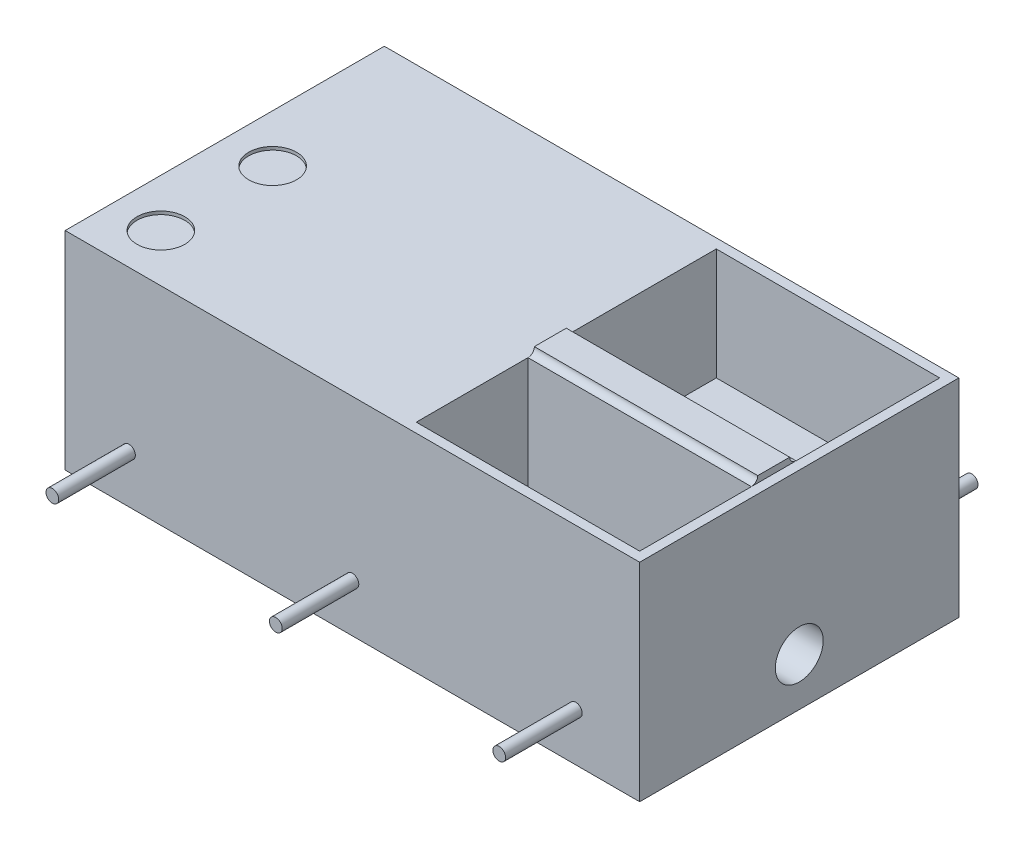
from build123d import *

# Parameters (mm, degrees)
SKIZZE1_W                            = 1800
SKIZZE1_H                            = 1000
AUFSATZ_LINEAR_AUSTRAGEN1_DEPTH      = 650
AUFSATZ_LINEAR_AUSTRAGEN2_DEPTH      = 740
AUFSATZ_LINEAR_AUSTRAGEN2_DEPTH_BACK = 740
SKIZZE2_R                            = 20
SKIZZE3_W                            = 700
SKIZZE3_H                            = 450
SKIZZE3_H_2                          = 350
SCHNITT_LINEAR_AUSTRAGEN1_DEPTH      = 350
SKIZZE4_W                            = 700
SKIZZE4_H                            = 140
AUFSATZ_LINEAR_AUSTRAGEN3_DEPTH      = 20
SKIZZE5_R                            = 20
SCHNITT_LINEAR_AUSTRAGEN2_DEPTH      = 700
SKIZZE6_R                            = 75
SCHNITT_LINEAR_AUSTRAGEN3_DEPTH      = 1800
SKIZZE7_R                            = 75
SCHNITT_LINEAR_AUSTRAGEN4_DEPTH      = 10
SKIZZE8_R                            = 75
SCHNITT_LINEAR_AUSTRAGEN5_DEPTH      = 10


with BuildPart() as part:
    # Skizze1 → Aufsatz-Linear austragen1 (new body)
    with BuildSketch(Plane(origin=(0, 0, 0), x_dir=(1, 0, 0), z_dir=(0, 1, 0))):
        Rectangle(SKIZZE1_W, SKIZZE1_H)
    extrude(amount=-AUFSATZ_LINEAR_AUSTRAGEN1_DEPTH)

    # Skizze2 → Aufsatz-Linear austragen2 (add, two sides: drawn at the far end of the back side and taken through both)
    with BuildSketch(Plane.XY.offset(-AUFSATZ_LINEAR_AUSTRAGEN2_DEPTH_BACK)):
        with Locations((0, -500)):
            Circle(SKIZZE2_R)
        with Locations((-700, -500)):
            Circle(SKIZZE2_R)
        with Locations(Location((700, -500, 0), (0, 0, 180))):
            Circle(SKIZZE2_R)
    extrude(amount=AUFSATZ_LINEAR_AUSTRAGEN2_DEPTH + AUFSATZ_LINEAR_AUSTRAGEN2_DEPTH_BACK)

    # Skizze3 → Schnitt-Linear austragen1 (cut)
    with BuildSketch(Plane(origin=(0, 0, 0), x_dir=(1, 0, 0), z_dir=(0, 1, 0))):
        with Locations((520, 245)):
            Rectangle(SKIZZE3_W, SKIZZE3_H)
        with Locations((520, -295)):
            Rectangle(SKIZZE3_W, SKIZZE3_H_2)
    extrude(amount=-SCHNITT_LINEAR_AUSTRAGEN1_DEPTH, mode=Mode.SUBTRACT)

    # Skizze4 → Aufsatz-Linear austragen3 (add)
    with BuildSketch(Plane(origin=(0, 0, 0), x_dir=(1, 0, 0), z_dir=(0, 1, 0))):
        with Locations((520, -50)):
            Rectangle(SKIZZE4_W, SKIZZE4_H)
    extrude(amount=AUFSATZ_LINEAR_AUSTRAGEN3_DEPTH)

    # Skizze5 → Schnitt-Linear austragen2 (cut)
    with BuildSketch(Plane(origin=(870, 0, 0), x_dir=(0, 0, -1), z_dir=(1, 0, 0))):
        with Locations((-120, 20)):
            Circle(SKIZZE5_R)
        with Locations((20, 20)):
            Circle(SKIZZE5_R)
    extrude(amount=-SCHNITT_LINEAR_AUSTRAGEN2_DEPTH, mode=Mode.SUBTRACT)

    # Skizze6 → Schnitt-Linear austragen3 (cut)
    with BuildSketch(Plane(origin=(900, 0, 0), x_dir=(0, 0, -1), z_dir=(1, 0, 0))):
        with Locations((0, -500)):
            Circle(SKIZZE6_R)
    extrude(amount=-SCHNITT_LINEAR_AUSTRAGEN3_DEPTH, mode=Mode.SUBTRACT)

    # Skizze7 → Schnitt-Linear austragen4 (cut)
    with BuildSketch(Plane(origin=(0, 0, 0), x_dir=(1, 0, 0), z_dir=(0, 1, 0))):
        with Locations(Location((-750, -350, 0), (0, 0, 270))):
            Circle(SKIZZE7_R)
    extrude(amount=-SCHNITT_LINEAR_AUSTRAGEN4_DEPTH, mode=Mode.SUBTRACT)

    # Skizze8 → Schnitt-Linear austragen5 (cut)
    with BuildSketch(Plane(origin=(0, 0, 0), x_dir=(1, 0, 0), z_dir=(0, 1, 0))):
        with Locations(Location((-750, 0, 0), (0, 0, 270))):
            Circle(SKIZZE8_R)
    extrude(amount=-SCHNITT_LINEAR_AUSTRAGEN5_DEPTH, mode=Mode.SUBTRACT)


solid = part.part
